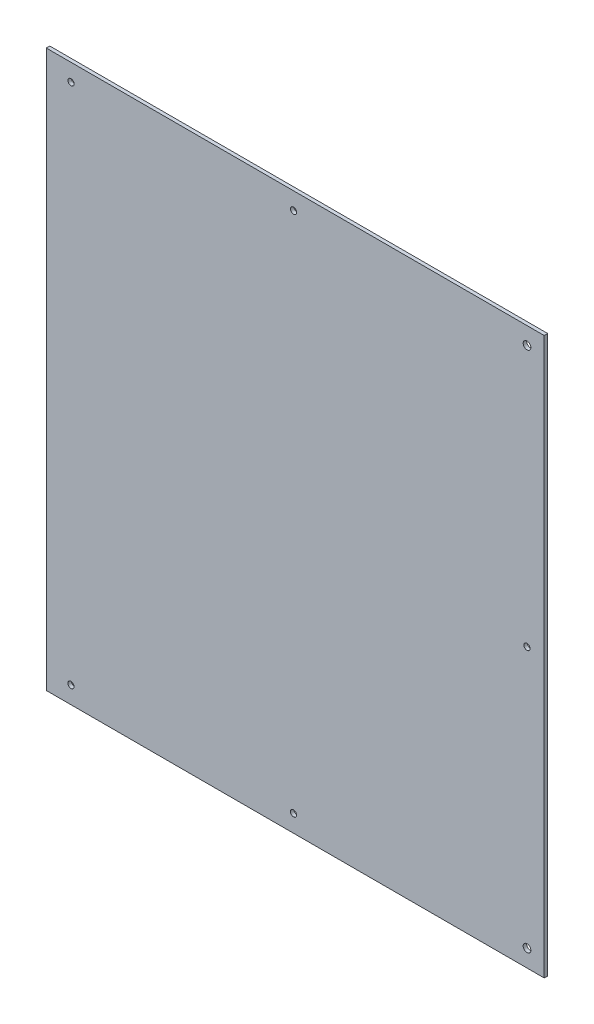
from build123d import *

# Parameters (mm, degrees)
SKETCH1_W           = 500
SKETCH1_H           = 450
SKETCH1_R           = 3.5
SKETCH1_R_2         = 2.8
BOSS_EXTRUDE1_DEPTH = 3.175
SKETCH2_W           = 3.175
SKETCH2_H           = 500
BOSS_EXTRUDE2_DEPTH = 3.175


with BuildPart() as part:
    # Sketch1 → Boss-Extrude1 (new body)
    with BuildSketch(Plane(origin=(0, 0, 0), x_dir=(0, 1, 0), z_dir=(0, 0, 1))):
        Rectangle(SKETCH1_W, SKETCH1_H)
        with Locations(Location((237.5, -212.5, 0), (0, 0, 270))):
            Circle(SKETCH1_R, mode=Mode.SUBTRACT)
        with Locations(Location((-237.5, -212.5, 0), (0, 0, 270))):
            Circle(SKETCH1_R, mode=Mode.SUBTRACT)
        with Locations(Location((-237.5, 202.5, 0), (0, 0, 270))):
            Circle(SKETCH1_R_2, mode=Mode.SUBTRACT)
        with Locations(Location((237.5, 202.5, 0), (0, 0, 270))):
            Circle(SKETCH1_R_2, mode=Mode.SUBTRACT)
        with Locations(Location((-237.5, 0, 0), (0, 0, 270))):
            Circle(SKETCH1_R_2, mode=Mode.SUBTRACT)
        with Locations(Location((237.5, 0, 0), (0, 0, 270))):
            Circle(SKETCH1_R_2, mode=Mode.SUBTRACT)
        with Locations(Location((0, -212.5, 0), (0, 0, 270))):
            Circle(SKETCH1_R_2, mode=Mode.SUBTRACT)
    extrude(amount=BOSS_EXTRUDE1_DEPTH)

    # Sketch2 → Boss-Extrude2 (add, through all)
    with BuildSketch(Plane.XY.offset(3.175)):
        Polygon((225, -250), (-225, -250), (-225, -253.175), (228.175, -253.175), (228.175, -250), align=None)
        with Locations((226.5875, 0)):
            Rectangle(SKETCH2_W, SKETCH2_H)
        Polygon((-225, 250), (225, 250), (228.175, 250), (228.175, 253.175), (-225, 253.175), align=None)
    extrude(amount=-BOSS_EXTRUDE2_DEPTH)


solid = part.part
